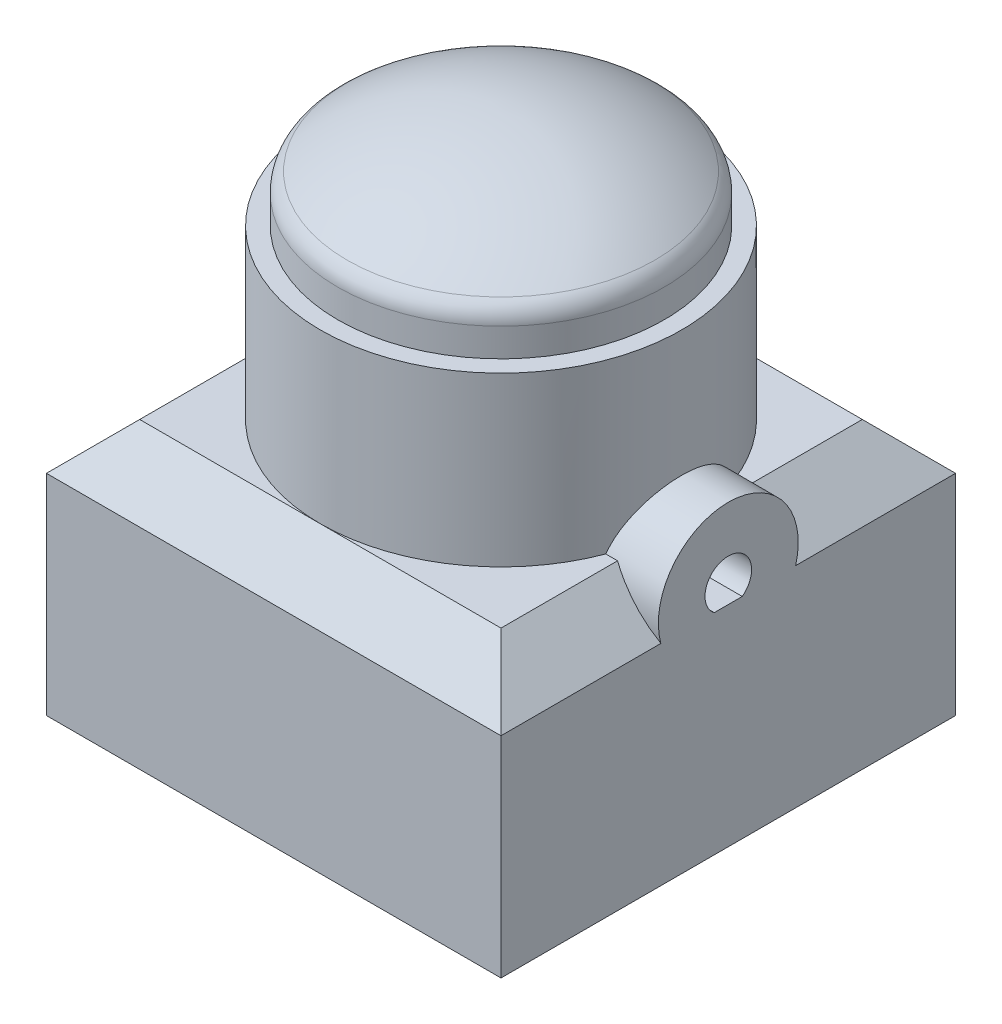
from build123d import *

# Parameters (mm, degrees)
CROQUIS1_W              = 19.5
CROQUIS1_H              = 19.5
SALIENTE_EXTRUIR1_DEPTH = 11
CHAFL_N1_SIZE           = 2
SALIENTE_EXTRUIR2_DEPTH = 9
CROQUIS3_R              = 7.75
SALIENTE_EXTRUIR3_DEPTH = 7.2
CORTAR_EXTRUIR1_DEPTH   = 3.2
CROQUIS5_R              = 7
SALIENTE_EXTRUIR4_DEPTH = 1.7
C_PULA1_FACE_RADIUS     = 7
C_PULA1_HEIGHT          = 2.5
REDONDEO1_R             = 1


with BuildPart() as part:
    # Croquis1 → Saliente-Extruir1 (new body)
    with BuildSketch(Plane(origin=(0, 0, 0), x_dir=(1, 0, 0), z_dir=(0, 1, 0))):
        Rectangle(CROQUIS1_W, CROQUIS1_H)
    extrude(amount=SALIENTE_EXTRUIR1_DEPTH)

    # Chaflán1
    chafl_n1_edges = [part.edges().sort_by_distance(p)[0] for p in [
        (-9.75, 11, 0),
        (0, 11, 9.75),
        (9.75, 11, 0),
        (0, 11, -9.75),
    ]]
    chamfer(chafl_n1_edges, length=CHAFL_N1_SIZE)

    # Croquis2 → Saliente-Extruir2 (add)
    with BuildSketch(Plane(origin=(9.75, 0, 0), x_dir=(0, 0, -1), z_dir=(1, 0, 0))):
        with BuildLine():
            ThreePointArc((-0.6, 9), (-0.447213595, 10.694427191), (1, 9.8))
            ThreePointArc((1, 9.8), (0.894427191, 9.352786405), (0.6, 9))
            Line((0.6, 9), (2.891366459, 9))
            ThreePointArc((2.891366459, 9), (2.972717559, 9.396328956), (3, 9.8))
            ThreePointArc((3, 9.8), (-0.403671044, 12.772717559), (-2.891366459, 9))
            Line((-2.891366459, 9), (-0.6, 9))
        make_face()
        with BuildLine():
            ThreePointArc((0.6, 9), (0, 8.8), (-0.6, 9))
            Line((-0.6, 9), (-2.891366459, 9))
            ThreePointArc((-2.891366459, 9), (0, 6.8), (2.891366459, 9))
            Line((2.891366459, 9), (0.6, 9))
        make_face()
    extrude(amount=-SALIENTE_EXTRUIR2_DEPTH)

    # Croquis3 → Saliente-Extruir3 (add)
    with BuildSketch(Plane(origin=(0, 11, 0), x_dir=(1, 0, 0), z_dir=(0, 1, 0))):
        with Locations(Location((0, 0, 0), (0, 0, 270))):
            Circle(CROQUIS3_R)
    extrude(amount=SALIENTE_EXTRUIR3_DEPTH)

    # Croquis4 → Cortar-Extruir1 (cut)
    with BuildSketch(Plane(origin=(9.75, 0, 0), x_dir=(0, 0, -1), z_dir=(1, 0, 0))):
        with BuildLine():
            Line((-0.6, 9), (0.6, 9))
            ThreePointArc((0.6, 9), (0, 10.8), (-0.6, 9))
        make_face()
    extrude(amount=-CORTAR_EXTRUIR1_DEPTH, mode=Mode.SUBTRACT)

    # Croquis5 → Saliente-Extruir4 (add)
    with BuildSketch(Plane(origin=(0, 18.2, 0), x_dir=(1, 0, 0), z_dir=(0, 1, 0))):
        with Locations(Location((0, 0, 0), (0, 0, 270))):
            Circle(CROQUIS5_R)
    extrude(amount=SALIENTE_EXTRUIR4_DEPTH)

    # Cúpula1: a dome of height H over a round flat face of radius A is a cap of a sphere of radius (A * A + H * H) / (2 * H)
    c_pula1_r = (C_PULA1_FACE_RADIUS * C_PULA1_FACE_RADIUS + C_PULA1_HEIGHT * C_PULA1_HEIGHT) / (2 * C_PULA1_HEIGHT)
    c_pula1_base = Plane((0, 19.9, 0), z_dir=(0, 1, 0))
    with Locations(c_pula1_base.offset(C_PULA1_HEIGHT - c_pula1_r)):
        c_pula1_ball = Sphere(c_pula1_r, mode=Mode.PRIVATE)
    add(split(c_pula1_ball, bisect_by=c_pula1_base, keep=Keep.TOP, mode=Mode.PRIVATE))

    # Redondeo1
    redondeo1_edges = [part.edges().sort_by_distance(p)[0] for p in [
        (0, 19.9, -7),
    ]]
    fillet(redondeo1_edges, radius=REDONDEO1_R)


solid = part.part
